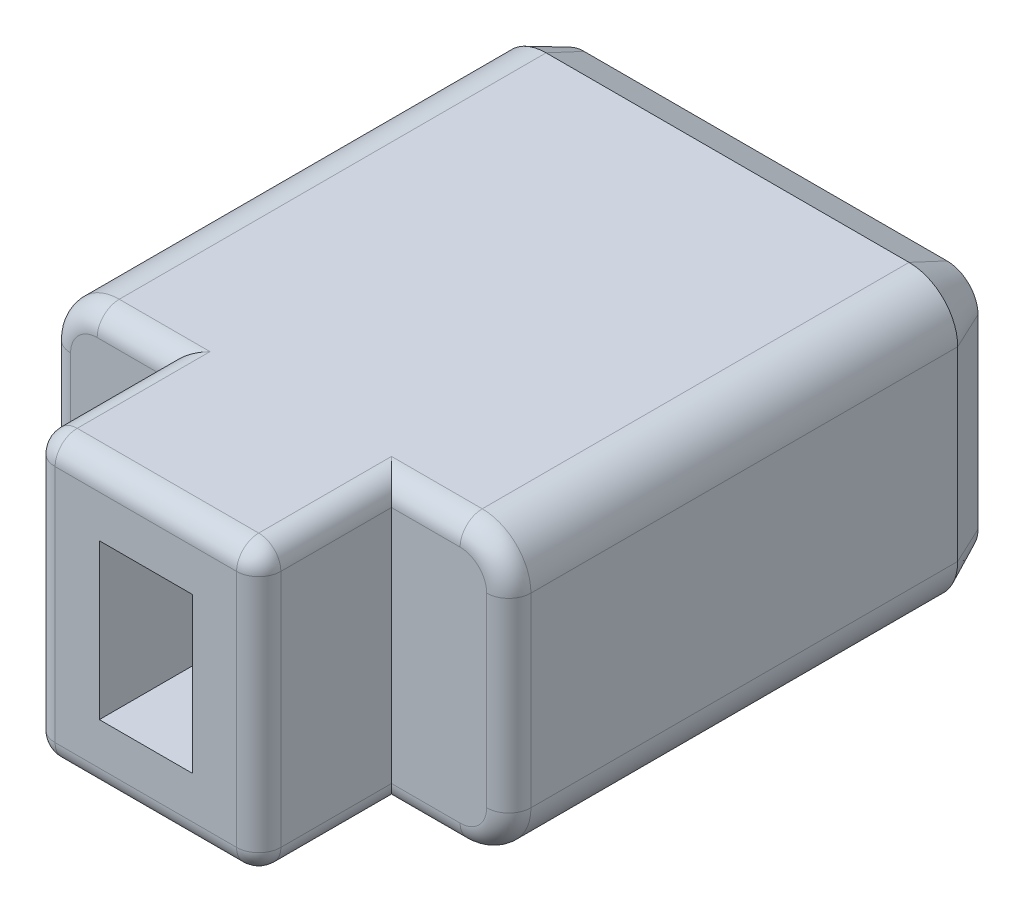
from build123d import *

# Parameters (mm, degrees)
BOSS_EXTRU_1_DEPTH      = 14
ESQUISSE3_W             = 2.1
ESQUISSE3_H             = 3.5
ENL_V_MAT_EXTRU_1_DEPTH = 3
ESQUISSE4_OUTSIDE_W     = 16.116
ESQUISSE4_OUTSIDE_H     = 12.116
ESQUISSE4_OUTSIDE_W_2   = 5.1
ESQUISSE4_OUTSIDE_H_2   = 6.4
ENL_V_MAT_EXTRU_2_DEPTH = 3
CONG_1_R                = 0.5
CHANFREIN1_SIZE         = 0.4
CHANFREIN1_SIZE2        = 0.857802768
ENL_V_MAT_EXTRU_3_DEPTH = 0.3
BOSS_EXTRU_2_DEPTH      = 0.3


with BuildPart() as part:
    # Esquisse2 → Boss.-Extru.1 (new body)
    with BuildSketch(Plane.XY):
        with BuildLine():
            Line((1.1, 0), (9.3, 0))
            ThreePointArc((9.3, 0), (10.077817459, 0.322182541), (10.4, 1.1))
            Line((10.4, 1.1), (10.4, 5.3))
            ThreePointArc((10.4, 5.3), (10.077817459, 6.077817459), (9.3, 6.4))
            Line((9.3, 6.4), (1.1, 6.4))
            ThreePointArc((1.1, 6.4), (0.322182541, 6.077817459), (0, 5.3))
            Line((0, 5.3), (0, 1.1))
            ThreePointArc((0, 1.1), (0.322182541, 0.322182541), (1.1, 0))
        make_face()
    extrude(amount=BOSS_EXTRU_1_DEPTH)

    # Esquisse3 → Enlèv. mat.-Extru.1 (cut)
    with BuildSketch(Plane.XY.offset(14)):
        with Locations((5.2, 3.2)):
            Rectangle(ESQUISSE3_W, ESQUISSE3_H)
    extrude(amount=-ENL_V_MAT_EXTRU_1_DEPTH, mode=Mode.SUBTRACT)

    # Esquisse4 outside → Enlèv. mat.-Extru.2 (cut)
    with BuildSketch(Plane.XY.offset(14)):
        with Locations((5.2, 3.2)):
            Rectangle(ESQUISSE4_OUTSIDE_W, ESQUISSE4_OUTSIDE_H)
        with Locations((5.2, 3.2)):
            Rectangle(ESQUISSE4_OUTSIDE_W_2, ESQUISSE4_OUTSIDE_H_2, mode=Mode.SUBTRACT)
    extrude(amount=-ENL_V_MAT_EXTRU_2_DEPTH, mode=Mode.SUBTRACT)

    # Congé1
    cong_1_edges = [part.edges().sort_by_distance(p)[0] for p in [
        (8.525, 0, 11),
        (10.077817459, 0.322182541, 11),
        (10.4, 3.2, 11),
        (10.077817459, 6.077817459, 11),
        (1.875, 6.4, 11),
        (0.322182541, 6.077817459, 11),
        (1.875, 0, 11),
        (0.322182541, 0.322182541, 11),
        (7.75, 6.4, 12.5),
        (2.65, 6.4, 12.5),
        (7.75, 0, 12.5),
        (2.65, 0, 12.5),
        (2.65, 3.2, 14),
        (5.2, 6.4, 14),
        (7.75, 3.2, 14),
        (5.2, 0, 14),
        (8.525, 6.4, 11),
        (0, 3.2, 11),
    ]]
    fillet(cong_1_edges, radius=CONG_1_R)

    # Chanfrein1
    chanfrein1_edges = [part.edges().sort_by_distance(p)[0] for p in [
        (5.2, 0, 0),
        (10.077817459, 0.322182541, 0),
        (0.322182541, 0.322182541, 0),
        (10.4, 3.2, 0),
        (0, 3.2, 0),
        (10.077817459, 6.077817459, 0),
        (0.322182541, 6.077817459, 0),
        (5.2, 6.4, 0),
    ]]
    chanfrein1_side = [part.faces().sort_by_distance(p)[0] for p in [
        (5.2, 3.2, 0),
    ]]
    chamfer(chanfrein1_edges, length=CHANFREIN1_SIZE, length2=CHANFREIN1_SIZE2, reference=chanfrein1_side[0])

    # Esquisse5 → Enlèv. mat.-Extru.3 (cut)
    with BuildSketch(Plane(origin=(0, 0, 0), x_dir=(-1, 0, 0), z_dir=(0, 0, -1))):
        Polygon((-4.225641026, 1.3), (-6.430769231, 1.3), (-4.584615385, 5.402564103), (-4.260897436, 5.225480769), (-5.842628205, 1.71025641), (-4.225641026, 1.71025641), align=None)
    extrude(amount=-ENL_V_MAT_EXTRU_3_DEPTH, mode=Mode.SUBTRACT)


with BuildPart() as body_2:
    # Esquisse5<2> → Boss.-Extru.2 (new body)
    with BuildSketch(Plane(origin=(0, 0, 0), x_dir=(-1, 0, 0), z_dir=(0, 0, -1))):
        Polygon((-4.225641026, 1.3), (-6.430769231, 1.3), (-4.584615385, 5.402564103), (-4.260897436, 5.225480769), (-5.842628205, 1.71025641), (-4.225641026, 1.71025641), align=None)
    extrude(amount=BOSS_EXTRU_2_DEPTH)


solid = Compound([part.part, body_2.part])
